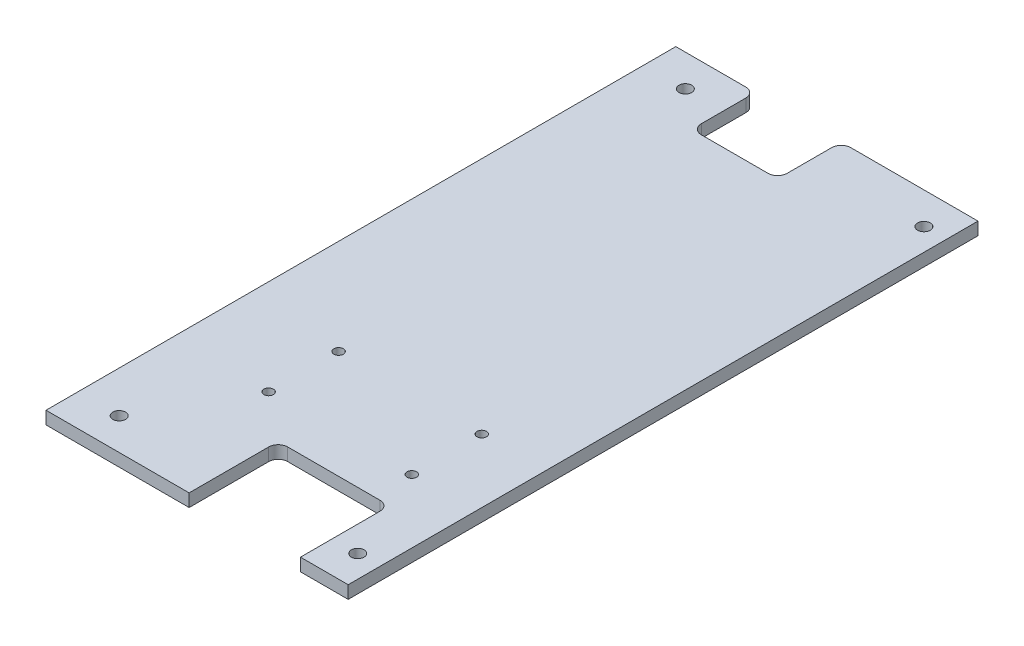
from build123d import *

# Parameters (mm, degrees)
SKETCH_1_W          = 95
SKETCH_1_H          = 198
EXTRUDE_1_DEPTH     = 4
SKETCH_2_W          = 35
SKETCH_2_H          = 28
CUT_EXTRUDE_1_DEPTH = 4
SKETCH_3_R          = 2
CUT_EXTRUDE_2_DEPTH = 110.878341815
SKETCH_4_R          = 2
CUT_EXTRUDE_3_DEPTH = 110.878341815
SKETCH_5_W          = 27
SKETCH_5_H          = 20
CUT_EXTRUDE_4_DEPTH = 110.878341815
SKETCH_6_R          = 1.5
CUT_EXTRUDE_5_DEPTH = 20
FILLET_1_R          = 3
FILLET_2_R          = 3


with BuildPart() as part:
    # 草图1 → 凸台-拉伸1 (new body)
    with BuildSketch(Plane(origin=(0, 0, 0), x_dir=(1, 0, 0), z_dir=(0, 1, 0))):
        Rectangle(SKETCH_1_W, SKETCH_1_H)
    extrude(amount=EXTRUDE_1_DEPTH)

    # 草图2 → 切除-拉伸1 (cut)
    with BuildSketch(Plane(origin=(0, 4, 0), x_dir=(1, 0, 0), z_dir=(0, 1, 0))):
        with Locations((15, -85)):
            Rectangle(SKETCH_2_W, SKETCH_2_H)
    extrude(amount=-CUT_EXTRUDE_1_DEPTH, mode=Mode.SUBTRACT)

    # 草图3 → 切除-拉伸2 (cut, through all)
    with BuildSketch(Plane(origin=(0, 4, 0), x_dir=(1, 0, 0), z_dir=(0, 1, 0))):
        with Locations(Location((40.5, -89, 0), (0, 0, 270))):
            Circle(SKETCH_3_R)
    extrude(amount=-CUT_EXTRUDE_2_DEPTH, mode=Mode.SUBTRACT)

    # 草图4 → 切除-拉伸3 (cut, through all)
    with BuildSketch(Plane(origin=(0, 4, 0), x_dir=(1, 0, 0), z_dir=(0, 1, 0))):
        with Locations(Location((40.5, 89, 0), (0, 0, 270))):
            Circle(SKETCH_4_R)
        with Locations(Location((-34.5, 89, 0), (0, 0, 270))):
            Circle(SKETCH_4_R)
        with Locations(Location((-34.5, -89, 0), (0, 0, 270))):
            Circle(SKETCH_4_R)
    extrude(amount=-CUT_EXTRUDE_3_DEPTH, mode=Mode.SUBTRACT)

    # 草图5 → 切除-拉伸4 (cut, through all)
    with BuildSketch(Plane(origin=(0, 4, 0), x_dir=(1, 0, 0), z_dir=(0, 1, 0))):
        with Locations((-9, 89)):
            Rectangle(SKETCH_5_W, SKETCH_5_H)
    extrude(amount=-CUT_EXTRUDE_4_DEPTH, mode=Mode.SUBTRACT)

    # 草图6 → 切除-拉伸5 (cut)
    with BuildSketch(Plane(origin=(0, 4, 0), x_dir=(1, 0, 0), z_dir=(0, 1, 0))):
        with Locations(Location((-17.5, -59, 0), (0, 0, 270))):
            Circle(SKETCH_6_R)
        with Locations(Location((27.5, -59, 0), (0, 0, 270))):
            Circle(SKETCH_6_R)
        with Locations(Location((27.5, -37, 0), (0, 0, 270))):
            Circle(SKETCH_6_R)
        with Locations(Location((-17.5, -37, 0), (0, 0, 270))):
            Circle(SKETCH_6_R)
    extrude(amount=-CUT_EXTRUDE_5_DEPTH, mode=Mode.SUBTRACT)

    # 圆角1
    fillet_1_edges = [part.edges().sort_by_distance(p)[0] for p in [
        (-2.5, 2, 71),
        (32.5, 2, 71),
    ]]
    fillet(fillet_1_edges, radius=FILLET_1_R)

    # 圆角2
    fillet_2_edges = [part.edges().sort_by_distance(p)[0] for p in [
        (-22.5, 2, -99),
        (4.5, 2, -99),
        (4.5, 2, -79),
        (-22.5, 2, -79),
    ]]
    fillet(fillet_2_edges, radius=FILLET_2_R)


solid = part.part
